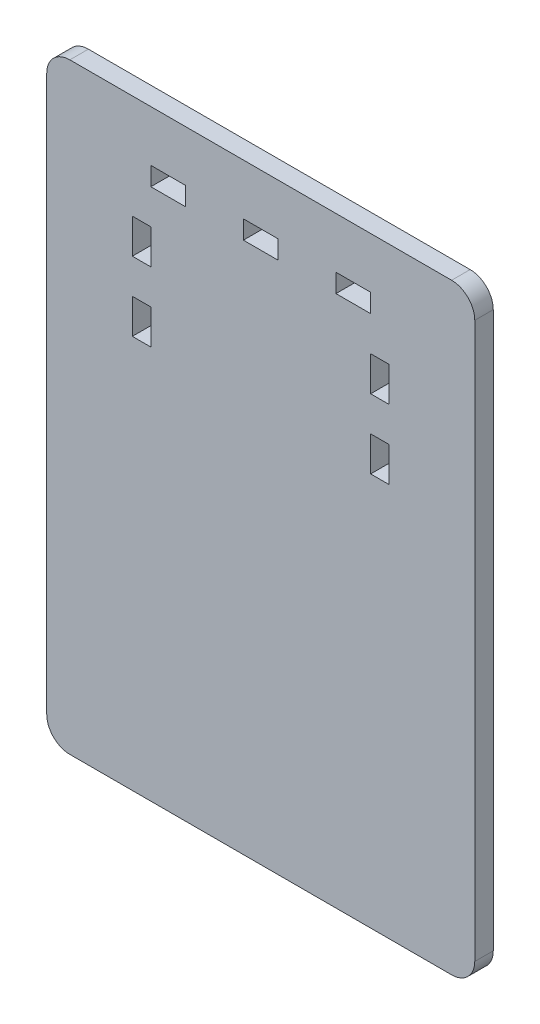
from build123d import *

# Parameters (mm, degrees)
BOSS_EXTRUDE1_DEPTH = 8
SKETCH2_W           = 15
SKETCH2_H           = 8
SKETCH2_W_2         = 8
SKETCH2_H_2         = 15
CUT_EXTRUDE1_DEPTH  = 160.750586853


with BuildPart() as part:
    # Sketch1 → Boss-Extrude1 (new body)
    with BuildSketch(Plane.XY):
        with BuildLine():
            Line((-82.5, -130), (82.5, -130))
            ThreePointArc((82.5, -130), (89.571067812, -127.071067812), (92.5, -120))
            Line((92.5, -120), (92.5, 120))
            ThreePointArc((92.5, 120), (89.571067812, 127.071067812), (82.5, 130))
            Line((82.5, 130), (-82.5, 130))
            ThreePointArc((-82.5, 130), (-89.571067812, 127.071067812), (-92.5, 120))
            Line((-92.5, 120), (-92.5, -120))
            ThreePointArc((-92.5, -120), (-89.571067812, -127.071067812), (-82.5, -130))
        make_face()
    extrude(amount=BOSS_EXTRUDE1_DEPTH)

    # Sketch2 → Cut-Extrude1 (cut, through all)
    with BuildSketch(Plane.XY.offset(8)):
        with Locations((0, 104)):
            Rectangle(SKETCH2_W, SKETCH2_H)
        with Locations((-40, 104)):
            Rectangle(SKETCH2_W, SKETCH2_H)
        with Locations((40, 104)):
            Rectangle(SKETCH2_W, SKETCH2_H)
        with Locations((-51.5, 47.5)):
            Rectangle(SKETCH2_W_2, SKETCH2_H_2)
        with Locations((-51.5, 77.5)):
            Rectangle(SKETCH2_W_2, SKETCH2_H_2)
        with Locations((51.5, 47.5)):
            Rectangle(SKETCH2_W_2, SKETCH2_H_2)
        with Locations((51.5, 77.5)):
            Rectangle(SKETCH2_W_2, SKETCH2_H_2)
    extrude(amount=-CUT_EXTRUDE1_DEPTH, mode=Mode.SUBTRACT)


solid = part.part
